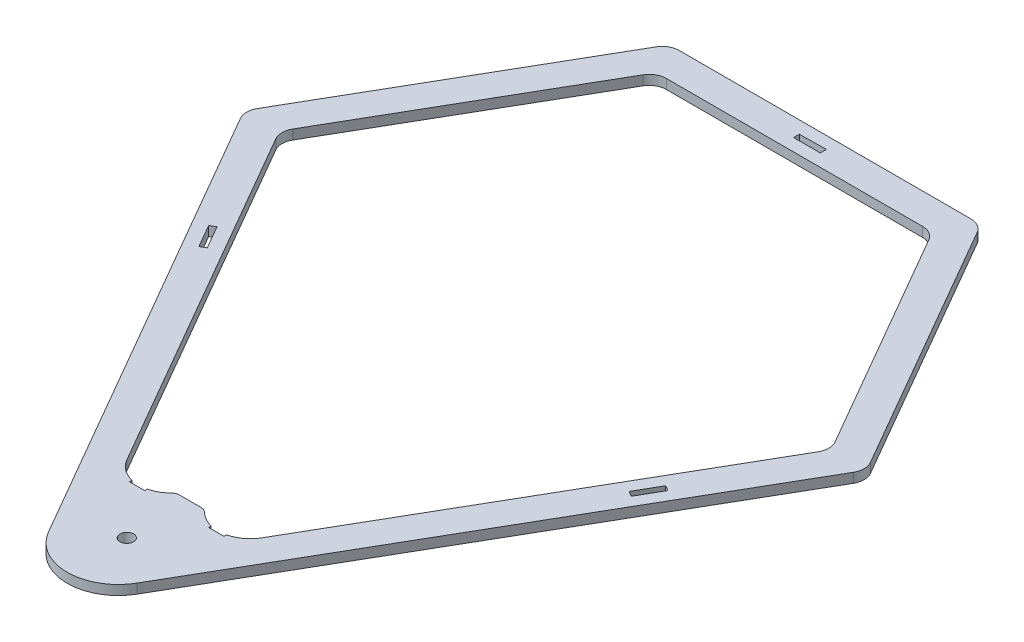
from build123d import *

# Parameters (mm, degrees)
SKETCH1_R           = 4
BOSS_EXTRUDE1_DEPTH = 5.63
FILLET1_R           = 10
FILLET2_R           = 30
FILLET4_R           = 5


with BuildPart() as part:
    # Sketch1 → Boss-Extrude1 (new body)
    with BuildSketch(Plane(origin=(0, 0, 0), x_dir=(1, 0, 0), z_dir=(0, 1, 0))):
        Polygon((-36.68543943, -242.805029456), (146.099170261, 73.78720137), (54.706865415, 232.083316783), (-128.077744275, 232.083316783), (-219.470049121, 73.78720137), align=None)
        with Locations(Location((-36.68543943, -177.805029456, 0), (0, 0, 270))):
            Circle(SKETCH1_R, mode=Mode.SUBTRACT)
        with BuildLine():
            Line((67.466052068, -26.409354497), (3.019043242, -138.03484818))
            ThreePointArc((3.019043242, -138.03484818), (-2.040687786, -143.738783032), (-8.93543943, -146.994263122))
            Line((-8.93543943, -146.994263122), (-8.93543943, -148.494263122))
            Line((-8.93543943, -148.494263122), (-17.93543943, -148.494263122))
            Line((-17.93543943, -148.494263122), (-17.93543943, -146.994263122))
            ThreePointArc((-17.93543943, -146.994263122), (-23.578815596, -144.600710123), (-28.166359293, -140.53484818))
            Line((-28.166359293, -140.53484818), (-45.204519567, -140.53484818))
            ThreePointArc((-45.204519567, -140.53484818), (-49.792063264, -144.600710123), (-55.43543943, -146.994263122))
            Line((-55.43543943, -146.994263122), (-55.43543943, -148.494263122))
            Line((-55.43543943, -148.494263122), (-64.43543943, -148.494263122))
            Line((-64.43543943, -148.494263122), (-64.43543943, -146.994263122))
            ThreePointArc((-64.43543943, -146.994263122), (-71.330191074, -143.738783032), (-76.389922102, -138.03484818))
            Line((-76.389922102, -138.03484818), (-198.68543943, 73.78720137))
            Line((-198.68543943, 73.78720137), (-117.68543943, 214.083316783))
            Line((-117.68543943, 214.083316783), (44.31456057, 214.083316783))
            Line((44.31456057, 214.083316783), (125.31456057, 73.78720137))
            Line((125.31456057, 73.78720137), (67.466052068, -26.409354497))
        make_face(mode=Mode.SUBTRACT)
        Polygon((-44.534572815, 224.766675876), (-28.836306045, 224.99995769), (-28.836306045, 221.39995769), (-44.534572815, 221.39995769), align=None, mode=Mode.SUBTRACT)
        Polygon((-171.463513791, 5.037443083), (-168.345822337, 6.837443083), (-160.495822337, -6.759155756), (-163.613513791, -8.559155756), align=None, mode=Mode.SUBTRACT)
        Polygon((98.092634931, 5.037443083), (94.974943477, 6.837443083), (87.124943477, -6.759155756), (90.242634931, -8.559155756), align=None, mode=Mode.SUBTRACT)
    extrude(amount=BOSS_EXTRUDE1_DEPTH)

    # Fillet1
    fillet1_edges = [part.edges().sort_by_distance(p)[0] for p in [
        (125.31456057, 2.815, -73.78720137),
        (44.31456057, 2.815, -214.083316783),
        (-117.68543943, 2.815, -214.083316783),
        (-198.68543943, 2.815, -73.78720137),
        (146.099170261, 2.815, -73.78720137),
        (-219.470049121, 2.815, -73.78720137),
        (-128.077744275, 2.815, -232.083316783),
        (54.706865415, 2.815, -232.083316783),
    ]]
    fillet(fillet1_edges, radius=FILLET1_R)

    # Fillet2
    fillet2_edges = [part.edges().sort_by_distance(p)[0] for p in [
        (-36.68543943, 2.815, 242.805029456),
    ]]
    fillet(fillet2_edges, radius=FILLET2_R)

    # Fillet4
    fillet4_edges = [part.edges().sort_by_distance(p)[0] for p in [
        (-45.204519567, 2.815, 140.53484818),
        (-28.166359293, 2.815, 140.53484818),
    ]]
    fillet(fillet4_edges, radius=FILLET4_R)


solid = part.part
